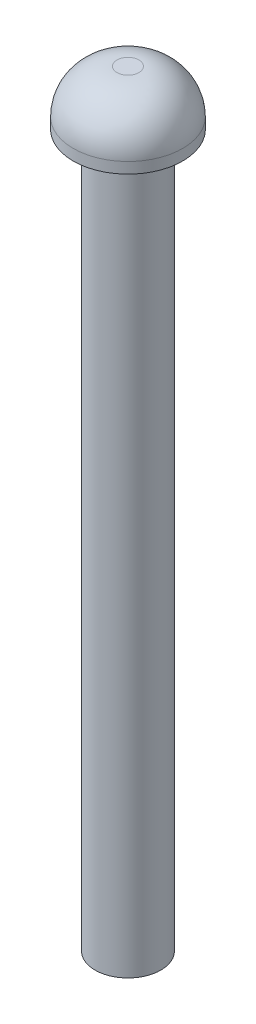
from build123d import *

# Parameters (mm, degrees)
ESBO_O1_R                = 3
RESSALTO_EXTRUS_O1_DEPTH = 65
ESBO_O2_R                = 5
RESSALTO_EXTRUS_O2_DEPTH = 5
FILETE1_R                = 4


with BuildPart() as part:
    # Esboço1 → Ressalto-extrusão1 (new body)
    with BuildSketch(Plane(origin=(0, 0, 0), x_dir=(1, 0, 0), z_dir=(0, 1, 0))):
        with Locations(Location((0, 0, 0), (0, 0, 270))):
            Circle(ESBO_O1_R)
    extrude(amount=RESSALTO_EXTRUS_O1_DEPTH)

    # Esboço2 → Ressalto-extrusão2 (add)
    with BuildSketch(Plane(origin=(0, 65, 0), x_dir=(1, 0, 0), z_dir=(0, 1, 0))):
        with Locations(Location((0, 0, 0), (0, 0, 270))):
            Circle(ESBO_O2_R)
    extrude(amount=RESSALTO_EXTRUS_O2_DEPTH)

    # Filete1
    filete1_edges = [part.edges().sort_by_distance(p)[0] for p in [
        (0, 70, -5),
    ]]
    fillet(filete1_edges, radius=FILETE1_R)


solid = part.part
